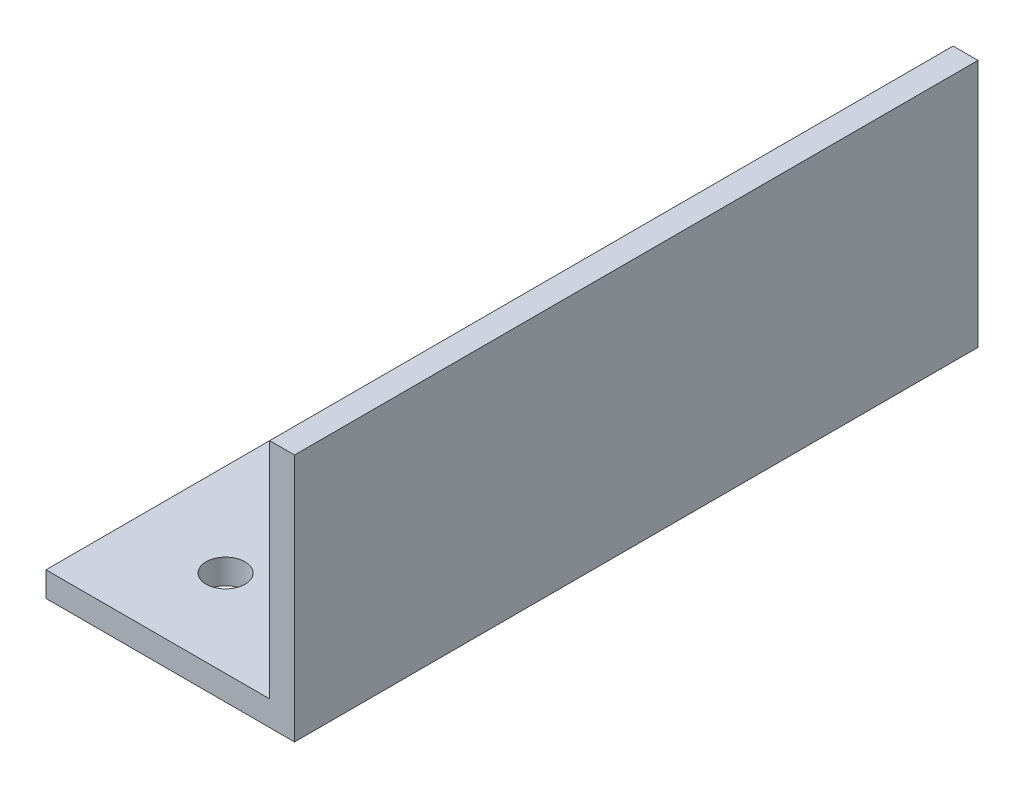
from build123d import *

# Parameters (mm, degrees)
SKETCH_1_W          = 18
SKETCH_1_H          = 2
SKETCH_1_W_2        = 2
SKETCH_1_H_2        = 20
EXTRUDE_1_DEPTH     = 55
SKETCH_2_R          = 1.566180025
CUT_EXTRUDE_1_DEPTH = 10


with BuildPart() as part:
    # Эскиз1 → Бобышка-Вытянуть1 (new body)
    with BuildSketch(Plane.XY):
        with Locations((-9, 1)):
            Rectangle(SKETCH_1_W, SKETCH_1_H)
        with Locations((1, 10)):
            Rectangle(SKETCH_1_W_2, SKETCH_1_H_2)
    extrude(amount=EXTRUDE_1_DEPTH)

    # Эскиз2 → Вырез-Вытянуть1 (cut)
    with BuildSketch(Plane.XZ):
        with Locations((-10.550157234, 7)):
            Circle(SKETCH_2_R)
        with Locations((-10.550157234, 48)):
            Circle(SKETCH_2_R)
    extrude(amount=-CUT_EXTRUDE_1_DEPTH, mode=Mode.SUBTRACT)


solid = part.part
